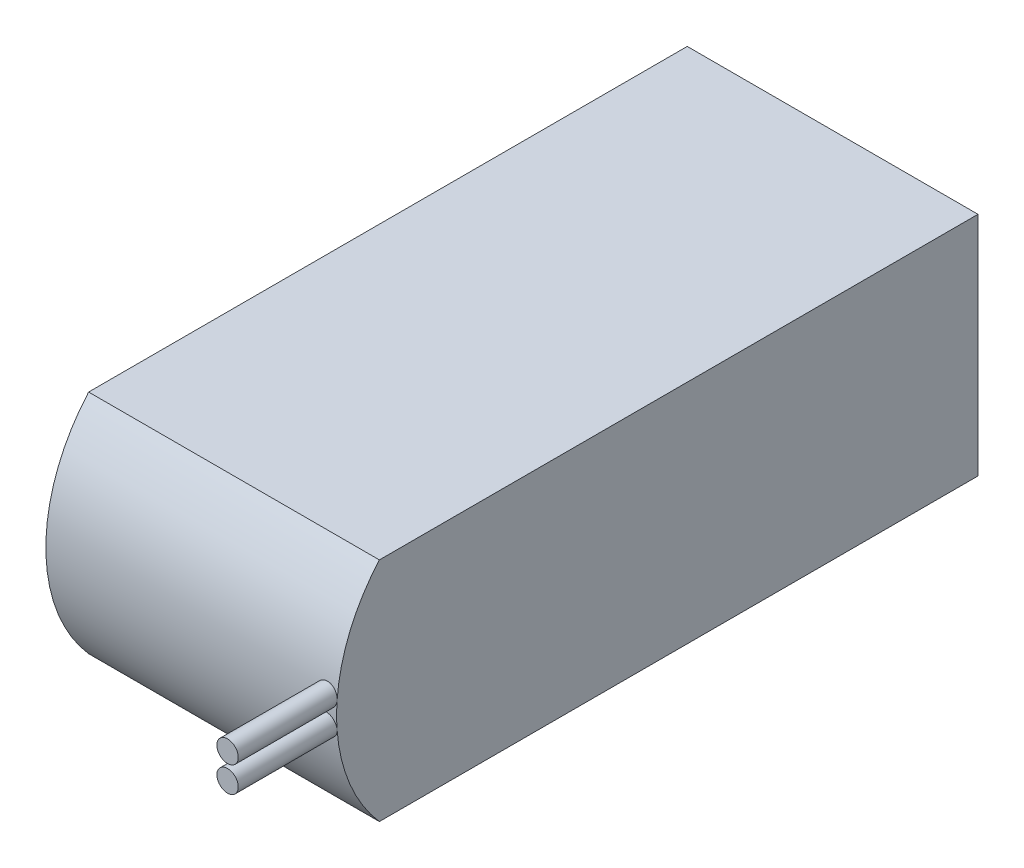
from build123d import *

# Parameters (mm, degrees)
ESQUISSE1_W        = 68
ESQUISSE1_H        = 53
BOSS_EXTRU_1_DEPTH = 140
BOSS_EXTRU_2_DEPTH = 68
ESQUISSE3_R        = 2.5
BOSS_EXTRU_3_DEPTH = 173


with BuildPart() as part:
    # Esquisse1 → Boss.-Extru.1 (new body)
    with BuildSketch(Plane.XY):
        with Locations((34, 26.5)):
            Rectangle(ESQUISSE1_W, ESQUISSE1_H)
    extrude(amount=BOSS_EXTRU_1_DEPTH)

    # Esquisse2 → Boss.-Extru.2 (add)
    with BuildSketch(Plane(origin=(68, 0, 0), x_dir=(0, 0, -1), z_dir=(1, 0, 0))):
        with BuildLine():
            Line((-140, 53), (-140, 0))
            ThreePointArc((-140, 0), (-150, 26.5), (-140, 53))
        make_face()
    extrude(amount=-BOSS_EXTRU_2_DEPTH)

    # Esquisse3 → Boss.-Extru.3 (add)
    with BuildSketch(Plane(origin=(0, 0, 0), x_dir=(-1, 0, 0), z_dir=(0, 0, -1))):
        with Locations((-65.5, 29.5)):
            Circle(ESQUISSE3_R)
        with Locations((-65.5, 23.5)):
            Circle(ESQUISSE3_R)
    extrude(amount=-BOSS_EXTRU_3_DEPTH)


solid = part.part
